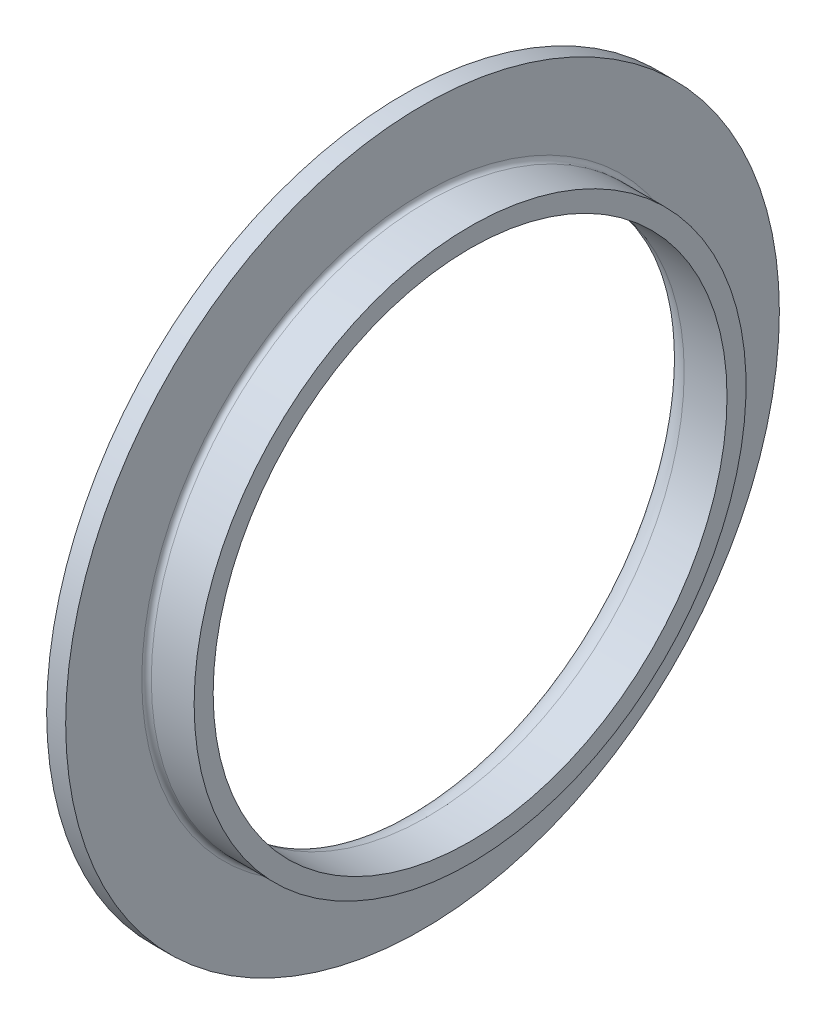
from build123d import *


with BuildPart() as part:
    # Esquisse1 → Base-Révol.-Mince (revolve)
    with BuildSketch(Plane.XY, mode=Mode.PRIVATE) as base_r_vol_mince_sk:
        with BuildLine():
            Line((0, 37.5), (0, 29.5))
            ThreePointArc((0, 29.5), (0.732233047, 27.732233047), (2.5, 27))
            Line((2.5, 27), (7, 27))
            Line((7, 27), (7, 29))
            Line((7, 29), (2.5, 29))
            ThreePointArc((2.5, 29), (2.146446609, 29.146446609), (2, 29.5))
            Line((2, 29.5), (2, 37.5))
            Line((2, 37.5), (0, 37.5))
        make_face()
    revolve(base_r_vol_mince_sk.sketch.rotate(Axis((0, 0, 0), (1, 0, 0)), 90), axis=Axis((0, 0, 0), (1, 0, 0)))


solid = part.part
